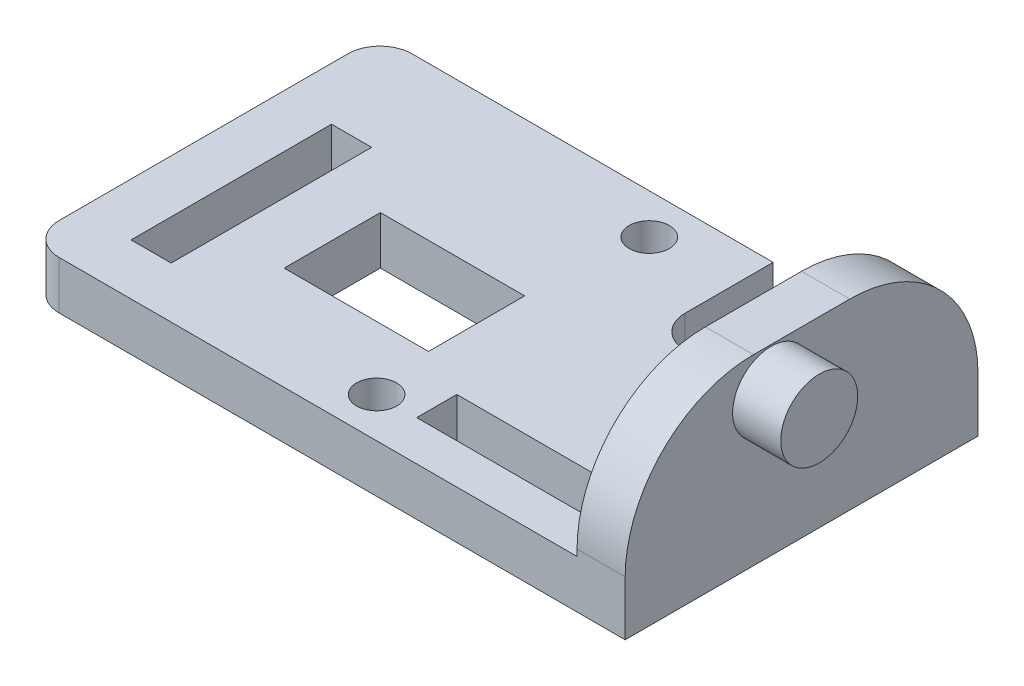
from build123d import *

# Parameters (mm, degrees)
SKETCH1_W           = 12.5
SKETCH1_H           = 2.5
SKETCH1_W_2         = 2.5
SKETCH1_H_2         = 12.5
SKETCH1_W_3         = 9
SKETCH1_H_3         = 6
BOSS_EXTRUDE1_DEPTH = 3
FILLET1_R           = 2
SKETCH1_4_W         = 3
SKETCH1_4_H         = 22
BOSS_EXTRUDE2_DEPTH = 11.4
SKETCH2_R           = 2.4
BOSS_EXTRUDE3_DEPTH = 3
FILLET2_R           = 8
SKETCH1_7_R         = 1.25
CUT_EXTRUDE2_DEPTH  = 54.067966791


with BuildPart() as part:
    # Sketch1 → Boss-Extrude1 (new body)
    with BuildSketch(Plane(origin=(0, 0, 0), x_dir=(1, 0, 0), z_dir=(0, 1, 0))):
        Polygon((-38.561763486, -34.630037485), (-1.270220731, -34.630037485), (-1.270220731, -12.630037485), (-4.270220731, -12.630037485), (-4.270220731, -20.12144272), (-14.041444449, -20.12144272), (-14.041444449, -12.630037485), (-38.561763486, -12.630037485), align=None)
        with Locations((-10.520220731, -30.880037485)):
            Rectangle(SKETCH1_W, SKETCH1_H, mode=Mode.SUBTRACT)
        with Locations((-34.020220731, -25.190037485)):
            Rectangle(SKETCH1_W_2, SKETCH1_H_2, mode=Mode.SUBTRACT)
        with Locations((-24.475907507, -25.190037485)):
            Rectangle(SKETCH1_W_3, SKETCH1_H_3, mode=Mode.SUBTRACT)
    extrude(amount=BOSS_EXTRUDE1_DEPTH)

    # Fillet1
    fillet1_edges = [part.edges().sort_by_distance(p)[0] for p in [
        (-38.561763486, 1.5, 12.630037485),
        (-38.561763486, 1.5, 34.630037485),
        (-1.270220731, 1.5, 34.630037485),
        (-14.041444449, 1.5, 20.12144272),
        (-4.270220731, 1.5, 20.12144272),
    ]]
    fillet(fillet1_edges, radius=FILLET1_R)

    # Sketch1<4> → Boss-Extrude2 (add)
    with BuildSketch(Plane(origin=(0, 0, 0), x_dir=(1, 0, 0), z_dir=(0, 1, 0))):
        with Locations((-2.770220731, -23.630037485)):
            Rectangle(SKETCH1_4_W, SKETCH1_4_H)
    extrude(amount=BOSS_EXTRUDE2_DEPTH)

    # Sketch2 → Boss-Extrude3 (add)
    with BuildSketch(Plane(origin=(-1.270220731, 0, 0), x_dir=(0, 0, -1), z_dir=(1, 0, 0))):
        with Locations((-25.530037485, 8.9)):
            Circle(SKETCH2_R)
    extrude(amount=BOSS_EXTRUDE3_DEPTH)

    # Fillet2
    fillet2_edges = [part.edges().sort_by_distance(p)[0] for p in [
        (-2.770220731, 11.4, 12.630037485),
        (-2.770220731, 11.4, 34.630037485),
    ]]
    fillet(fillet2_edges, radius=FILLET2_R)

    # Sketch1<7> → Cut-Extrude2 (cut, through all)
    with BuildSketch(Plane(origin=(0, 0, 0), x_dir=(1, 0, 0), z_dir=(0, 1, 0))):
        with Locations((-19.270220731, -32.130037485)):
            Circle(SKETCH1_7_R)
        with Locations((-19.270220731, -15.130037485)):
            Circle(SKETCH1_7_R)
    extrude(amount=CUT_EXTRUDE2_DEPTH, mode=Mode.SUBTRACT)


solid = part.part
